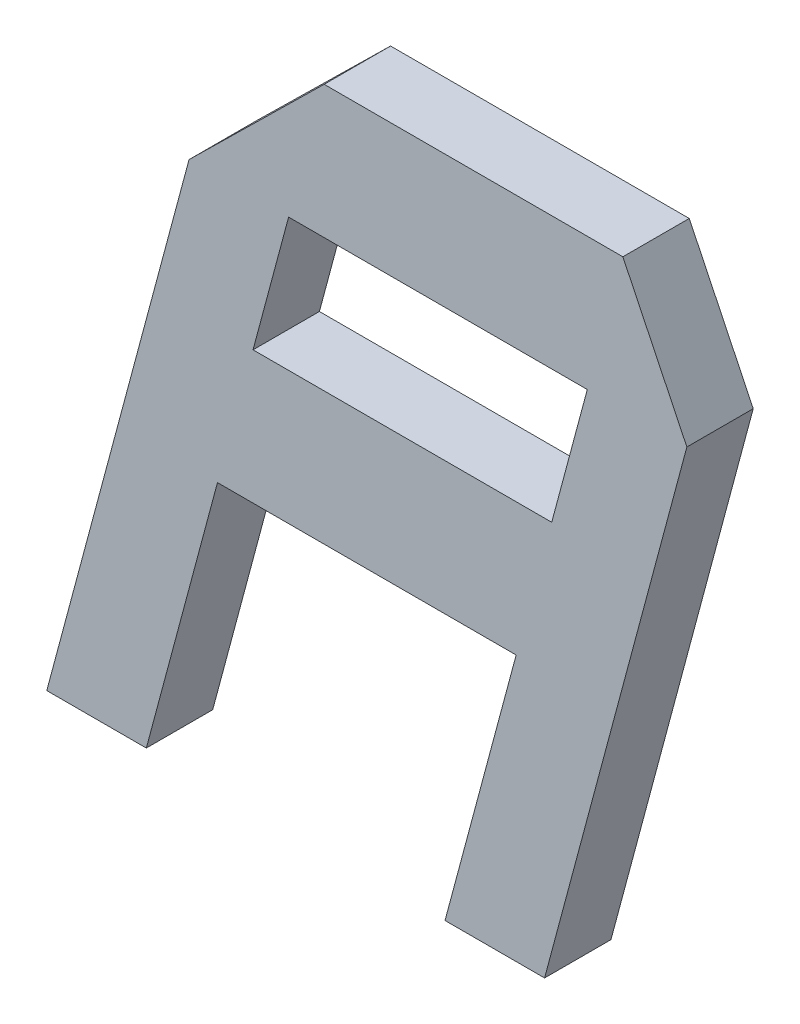
from build123d import *

# Parameters (mm, degrees)
EXTRUDE_A_DEPTH = 10


with BuildPart() as part:
    # Skica5 → A_ (new body)
    with BuildSketch(Plane.XY):
        Polygon((0, 0), (21.435935394, 80), (41.794919243, 100), (86.794919243, 100), (96.435935394, 80), (75, 0), (60, 0), (70.717967697, 40), (25.717967697, 40), (15, 0), align=None)
        Polygon((36.435935394, 80), (81.435935394, 80), (76.076951546, 60), (31.076951546, 60), align=None, mode=Mode.SUBTRACT)
    extrude(amount=EXTRUDE_A_DEPTH)


solid = part.part
